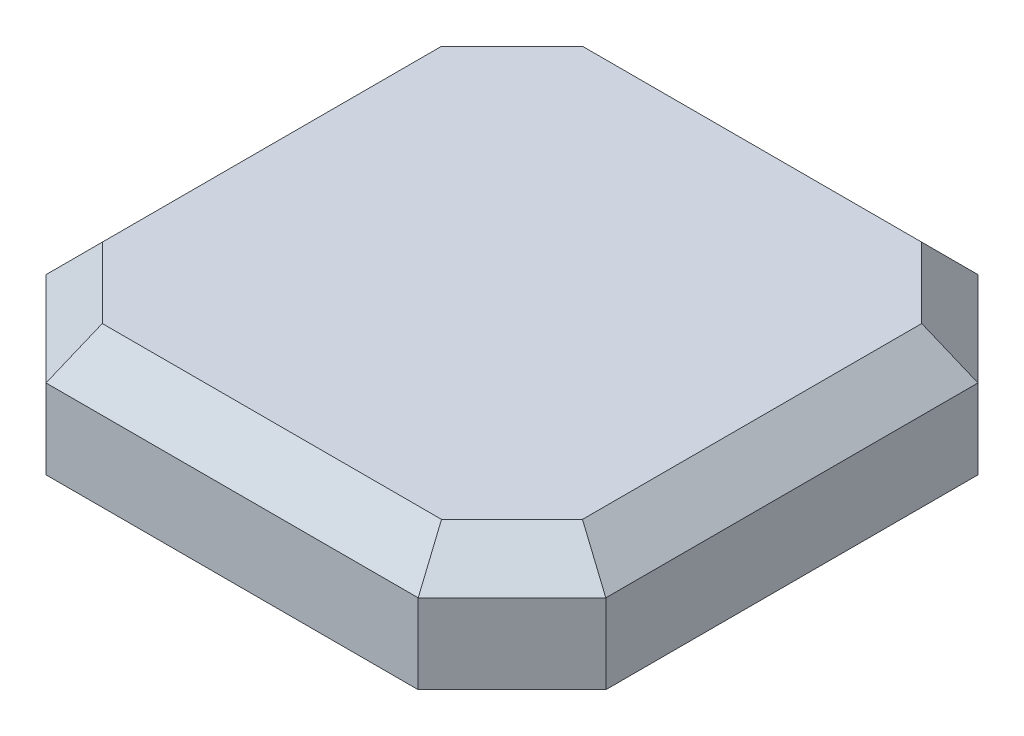
from build123d import *

# Parameters (mm, degrees)
EXTRUDE_1_DEPTH = 9
CHAMFER_1_SIZE  = 3
SKETCH_3_R      = 3
SKETCH_3_R_2    = 2.5
EXTRUDE_2_DEPTH = 1


with BuildPart() as part:
    # 草图1 → 凸台-拉伸1 (new body)
    with BuildSketch(Plane(origin=(0, 0, 0), x_dir=(1, 0, 0), z_dir=(0, 1, 0))):
        Polygon((-18.403562193, 20.210244745), (-25.474630004, 13.139176933), (-25.474630004, -14.918687443), (-18.403562193, -21.989755255), (9.654302184, -21.989755255), (16.725369996, -14.918687443), (16.725369996, 13.139176933), (9.654302184, 20.210244745), align=None)
    extrude(amount=EXTRUDE_1_DEPTH)

    # 倒角1
    chamfer_1_edges = [part.edges().sort_by_distance(p)[0] for p in [
        (-25.474630004, 9, 0.889755255),
        (-21.939096098, 9, 18.454221349),
        (-4.374630004, 9, 21.989755255),
        (13.18983609, 9, 18.454221349),
        (16.725369996, 9, 0.889755255),
        (13.18983609, 9, -16.674710839),
        (-4.374630004, 9, -20.210244745),
        (-21.939096098, 9, -16.674710839),
    ]]
    chamfer(chamfer_1_edges, length=CHAMFER_1_SIZE)

    # 草图3 → 凸台-拉伸2 (add)
    # profile 1 of 4: a face of its own
    with BuildSketch(Plane.XZ):
        with Locations(Location((9.434831814, 14.699217073, 0), (0, 0, 90))):
            Circle(SKETCH_3_R)
        with Locations(Location((9.434831814, 14.699217073, 0), (0, 0, 270))):
            Circle(SKETCH_3_R_2, mode=Mode.SUBTRACT)
    # profile 2 of 4: a face of its own
    with BuildSketch(Plane.XZ):
        with Locations(Location((9.434831814, -12.919706563, 0), (0, 0, 90))):
            Circle(SKETCH_3_R)
        with Locations(Location((9.434831814, -12.919706563, 0), (0, 0, 270))):
            Circle(SKETCH_3_R_2, mode=Mode.SUBTRACT)
    # profile 3 of 4: a face of its own
    with BuildSketch(Plane.XZ):
        with Locations(Location((-18.184091822, -12.919706563, 0), (0, 0, 90))):
            Circle(SKETCH_3_R)
        with Locations(Location((-18.184091822, -12.919706563, 0), (0, 0, 270))):
            Circle(SKETCH_3_R_2, mode=Mode.SUBTRACT)
    # profile 4 of 4: a face of its own
    with BuildSketch(Plane.XZ):
        with Locations(Location((-18.184091822, 14.699217073, 0), (0, 0, 90))):
            Circle(SKETCH_3_R)
        with Locations(Location((-18.184091822, 14.699217073, 0), (0, 0, 270))):
            Circle(SKETCH_3_R_2, mode=Mode.SUBTRACT)
    extrude(amount=EXTRUDE_2_DEPTH)


solid = part.part
